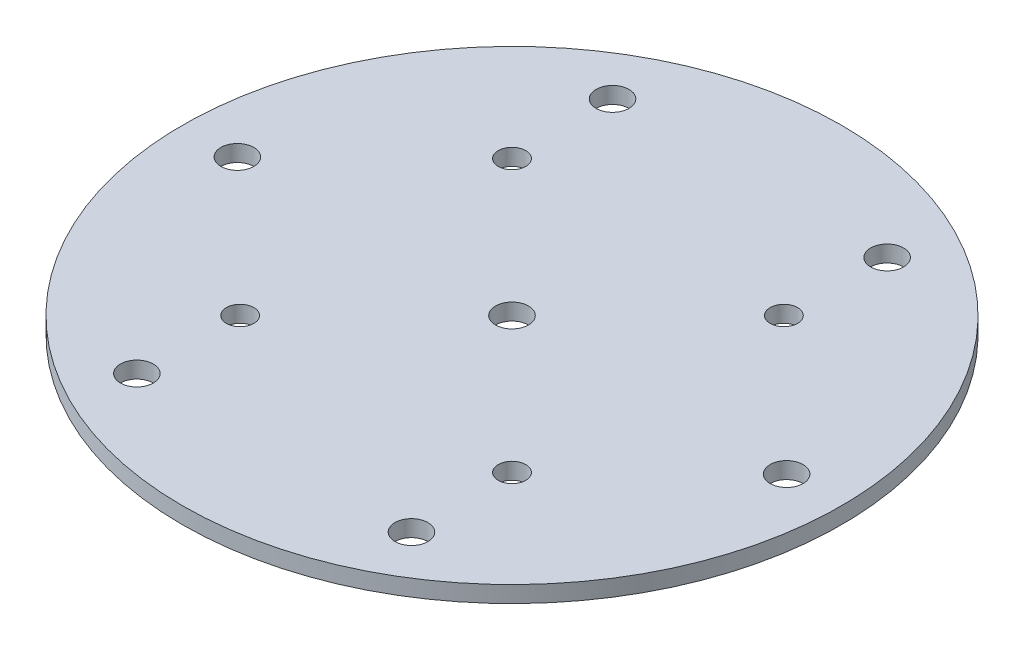
from build123d import *

# Parameters (mm, degrees)
SKETCH1_R               = 60
SKETCH1_R_2             = 2.5
SKETCH1_R_3             = 3
BOSS_EXTRUDE1_DEPTH     = 3
CUT_EXTRUDE1_DEPTH      = 85.905830189
CUT_EXTRUDE1_DEPTH_BACK = 85.905830189
SKETCH2_R               = 3


with BuildPart() as part:
    # Sketch1 → Boss-Extrude1 (new body)
    with BuildSketch(Plane(origin=(0, 0, 0), x_dir=(1, 0, 0), z_dir=(0, 1, 0))):
        with Locations(Location((0, 0, 0), (0, 0, 270))):
            Circle(SKETCH1_R)
        with Locations(Location((-24.748737342, -24.748737342, 0), (0, 0, 270))):
            Circle(SKETCH1_R_2, mode=Mode.SUBTRACT)
        with Locations(Location((24.748737342, -24.748737342, 0), (0, 0, 270))):
            Circle(SKETCH1_R_2, mode=Mode.SUBTRACT)
        with Locations(Location((24.748737342, 24.748737342, 0), (0, 0, 270))):
            Circle(SKETCH1_R_2, mode=Mode.SUBTRACT)
        with Locations(Location((-24.748737342, 24.748737342, 0), (0, 0, 270))):
            Circle(SKETCH1_R_2, mode=Mode.SUBTRACT)
        with Locations(Location((-25, -43.301270189, 0), (0, 0, 270))):
            Circle(SKETCH1_R_3, mode=Mode.SUBTRACT)
        with Locations(Location((25, -43.301270189, 0), (0, 0, 270))):
            Circle(SKETCH1_R_3, mode=Mode.SUBTRACT)
        with Locations(Location((50, 0, 0), (0, 0, 270))):
            Circle(SKETCH1_R_3, mode=Mode.SUBTRACT)
        with Locations(Location((25, 43.301270189, 0), (0, 0, 270))):
            Circle(SKETCH1_R_3, mode=Mode.SUBTRACT)
        with Locations(Location((-25, 43.301270189, 0), (0, 0, 270))):
            Circle(SKETCH1_R_3, mode=Mode.SUBTRACT)
        with Locations(Location((-50, 0, 0), (0, 0, 270))):
            Circle(SKETCH1_R_3, mode=Mode.SUBTRACT)
    extrude(amount=BOSS_EXTRUDE1_DEPTH)

    # Sketch2 → Cut-Extrude1 (cut, two sides: drawn at the far end of the back side and taken through both)
    with BuildSketch(Plane(origin=(0, 3, 0), x_dir=(1, 0, 0), z_dir=(0, 1, 0)).offset(-CUT_EXTRUDE1_DEPTH_BACK)):
        with Locations(Location((0, 0, 0), (0, 0, 270))):
            Circle(SKETCH2_R)
    extrude(amount=CUT_EXTRUDE1_DEPTH + CUT_EXTRUDE1_DEPTH_BACK, mode=Mode.SUBTRACT)


solid = part.part
